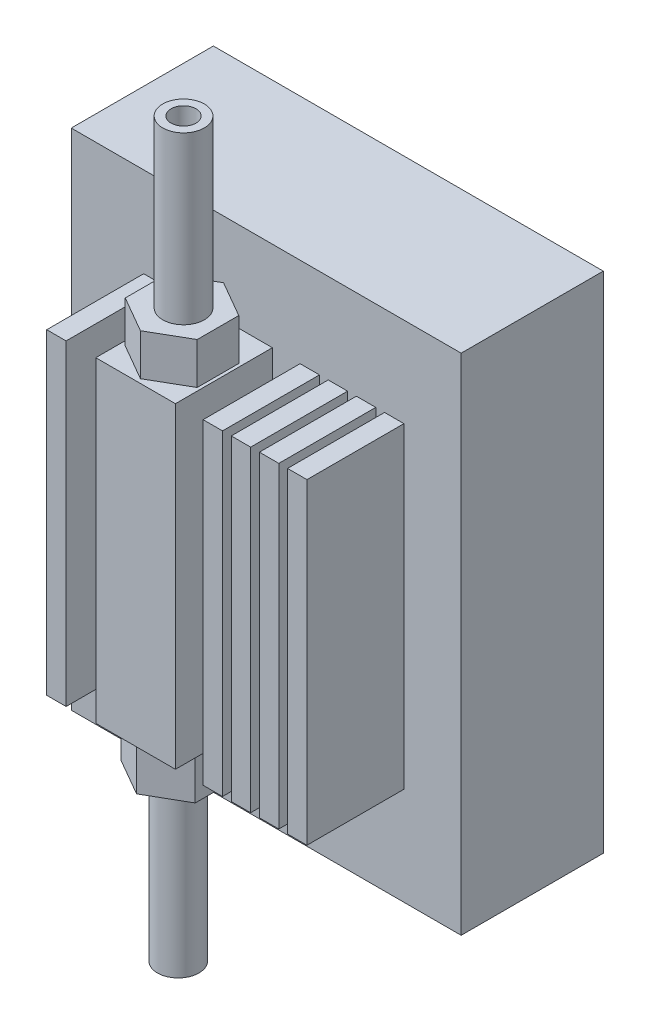
from build123d import *

# Parameters (mm, degrees)
SKETCH1_W           = 28.15
SKETCH1_H           = 36.4
BOSS_EXTRUDE1_DEPTH = 10.26
SKETCH2_W           = 5.75
SKETCH2_H           = 22.86
SKETCH2_W_2         = 1.4
BOSS_EXTRUDE5_DEPTH = 7
BOSS_EXTRUDE6_DEPTH = 3
SKETCH5_R           = 1.5
SKETCH5_R_2         = 0.9
BOSS_EXTRUDE7_DEPTH = 12
BOSS_EXTRUDE8_DEPTH = 3
SKETCH8_R           = 1.5
SKETCH8_R_2         = 0.9
BOSS_EXTRUDE9_DEPTH = 12


with BuildPart() as part:
    # Sketch1 → Boss-Extrude1 (new body)
    with BuildSketch(Plane.XY):
        with Locations((-756.790122614, 155.279969002)):
            Rectangle(SKETCH1_W, SKETCH1_H)
    extrude(amount=BOSS_EXTRUDE1_DEPTH)

    # Sketch2 → Boss-Extrude5 (add)
    with BuildSketch(Plane.XY.offset(10.26)):
        with Locations((-759.219593617, 155.576927604)):
            Rectangle(SKETCH2_W, SKETCH2_H)
        with Locations((-753.644593617, 155.576927604)):
            Rectangle(SKETCH2_W_2, SKETCH2_H)
        with Locations((-749.580593617, 155.576927604)):
            Rectangle(SKETCH2_W_2, SKETCH2_H)
        with Locations((-747.548593617, 155.576927604)):
            Rectangle(SKETCH2_W_2, SKETCH2_H)
        with Locations((-751.612593617, 155.576927604)):
            Rectangle(SKETCH2_W_2, SKETCH2_H)
        with Locations((-764.936255693, 155.555778802)):
            Rectangle(SKETCH2_W_2, SKETCH2_H)
    extrude(amount=BOSS_EXTRUDE5_DEPTH)

    # Sketch4 → Boss-Extrude6 (add)
    with BuildSketch(Plane.XZ.offset(-144.146927604)):
        Polygon((-759.208791207, 11.000445338), (-756.524112455, 12.550445338), (-756.524112455, 15.650445338), (-759.208791207, 17.200445338), (-761.893469959, 15.650445338), (-761.893469959, 12.550445338), align=None)
    extrude(amount=BOSS_EXTRUDE6_DEPTH)

    # Sketch5 → Boss-Extrude7 (add)
    with BuildSketch(Plane.XZ.offset(-141.146927604)):
        with Locations(Location((-759.25539639, 14.147787096, 0), (0, 0, 270))):
            Circle(SKETCH5_R)
        with Locations(Location((-759.25539639, 14.147787096, 0), (0, 0, 270))):
            Circle(SKETCH5_R_2, mode=Mode.SUBTRACT)
    extrude(amount=BOSS_EXTRUDE7_DEPTH)

    # Sketch6 → Boss-Extrude8 (add)
    with BuildSketch(Plane(origin=(0, 167.006927604, 0), x_dir=(1, 0, 0), z_dir=(0, 1, 0))):
        Polygon((-759.16759572, -16.962225379), (-756.569519509, -15.462225379), (-756.569519509, -12.462225379), (-759.16759572, -10.962225379), (-761.765671931, -12.462225379), (-761.765671931, -15.462225379), align=None)
    extrude(amount=BOSS_EXTRUDE8_DEPTH)

    # Sketch8 → Boss-Extrude9 (add)
    with BuildSketch(Plane(origin=(0, 170.006927604, 0), x_dir=(1, 0, 0), z_dir=(0, 1, 0))):
        with Locations(Location((-759.042188193, -13.976282546, 0), (0, 0, 270))):
            Circle(SKETCH8_R)
        with Locations(Location((-759.042188193, -13.976282546, 0), (0, 0, 270))):
            Circle(SKETCH8_R_2, mode=Mode.SUBTRACT)
    extrude(amount=BOSS_EXTRUDE9_DEPTH)


solid = part.part
